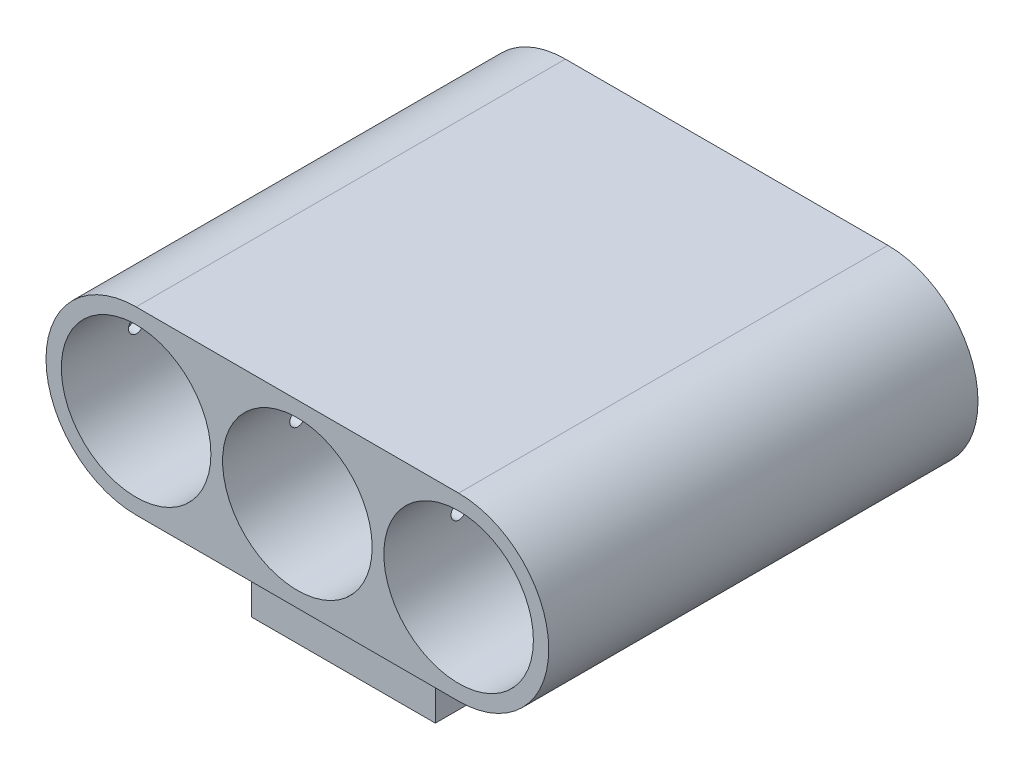
from build123d import *

# Parameters (mm, degrees)
SKETCH1_W                = 12
SKETCH1_H                = 22
BOSS_EXTRUDE1_DEPTH      = 5
BOSS_EXTRUDE2_DEPTH      = 3
BOSS_EXTRUDE2_DEPTH_BACK = 25
SKETCH2_R                = 4.877853957
CUT_EXTRUDE1_DEPTH       = 16
CUT_EXTRUDE1_DEPTH_BACK  = 16
SKETCH4_R                = 0.5


with BuildPart() as part:
    # Sketch1 → Boss-Extrude1 (new body)
    with BuildSketch(Plane(origin=(0, 0, 0), x_dir=(1, 0, 0), z_dir=(0, 1, 0))):
        with Locations((6.730337079, 0)):
            Rectangle(SKETCH1_W, SKETCH1_H)
    extrude(amount=BOSS_EXTRUDE1_DEPTH)

    # Sketch2 → Boss-Extrude2 (add, two sides: drawn at the far end of the back side and taken through both)
    with BuildSketch(Plane.XY.offset(11).offset(-BOSS_EXTRUDE2_DEPTH_BACK)):
        with BuildLine():
            Line((-3.78803397, 16.755707913), (17.248708128, 16.755707913))
            ThreePointArc((17.248708128, 16.755707913), (23.126562084, 10.877853957), (17.248708128, 5))
            Line((17.248708128, 5), (-3.78803397, 5))
            ThreePointArc((-3.78803397, 5), (-9.665887927, 10.877853957), (-3.78803397, 16.755707913))
        make_face()
        with Locations((17.248708128, 10.877853957)):
            Circle(SKETCH2_R, mode=Mode.SUBTRACT)
        with Locations((6.730337079, 10.877853957)):
            Circle(SKETCH2_R, mode=Mode.SUBTRACT)
        with Locations((-3.78803397, 10.877853957)):
            Circle(SKETCH2_R, mode=Mode.SUBTRACT)
    extrude(amount=BOSS_EXTRUDE2_DEPTH + BOSS_EXTRUDE2_DEPTH_BACK)

    # Sketch4 → Cut-Extrude1 (cut, two sides: drawn at the far end of the back side and taken through both)
    with BuildSketch(Plane(origin=(6.730337079, 0, 0), x_dir=(0, 0, -1), z_dir=(1, 0, 0)).offset(-CUT_EXTRUDE1_DEPTH_BACK)):
        with Locations((-9.12, 10.877853957)):
            Circle(SKETCH4_R)
    extrude(amount=CUT_EXTRUDE1_DEPTH + CUT_EXTRUDE1_DEPTH_BACK, mode=Mode.SUBTRACT)


solid = part.part
